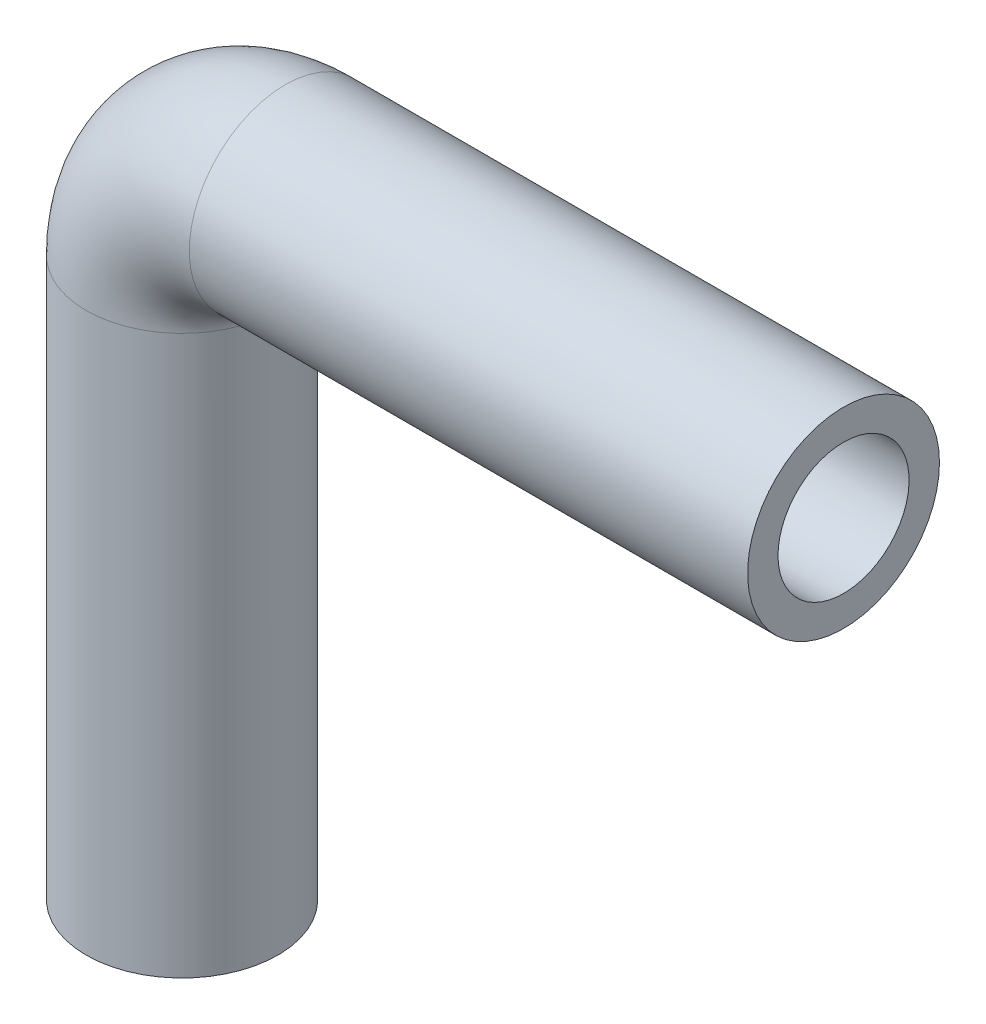
from build123d import *

# Parameters (mm, degrees)
SWEEP_THIN6_PROFILE_R   = 9.125
SWEEP_THIN6_PROFILE_R_2 = 6.235


with BuildPart() as part:
    # Sweep-Thin6: sweep along a path in Sketch78
    with BuildLine(Plane.XY) as sweep_thin6_path:
        Line((0, 0), (0, 53.104143086))
        ThreePointArc((0, 53.104143086), (2.874997927, 60.045002073), (9.815856914, 62.92))
        Line((9.815856914, 62.92), (62.92, 62.92))
    # Sweep-Thin6 profile (on start of the path) → Sweep-Thin6 (sweep)
    with BuildSketch(Plane.ZX):
        Circle(SWEEP_THIN6_PROFILE_R)
        Circle(SWEEP_THIN6_PROFILE_R_2, mode=Mode.SUBTRACT)
    sweep(path=sweep_thin6_path.line)


solid = part.part
